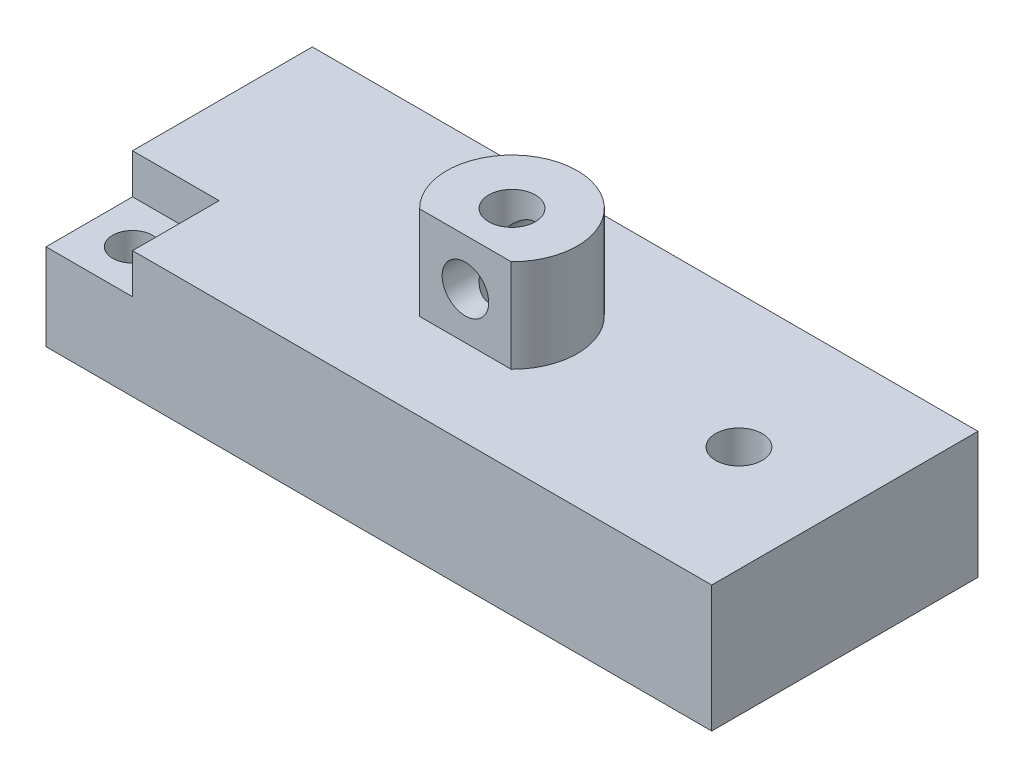
from build123d import *

# Parameters (mm, degrees)
SKETCH_1_W          = 100
SKETCH_1_H          = 40
EXTRUDE_1_DEPTH     = 19
SKETCH_2_R          = 9.811124868
EXTRUDE_2_DEPTH     = 14
SKETCH_3_W          = 13
SKETCH_3_H          = 13
CUT_EXTRUDE_1_DEPTH = 6
SKETCH_4_R          = 3
CUT_EXTRUDE_2_DEPTH = 110.544511501
SKETCH_5_R          = 3.5
CUT_EXTRUDE_3_DEPTH = 113.645461515
SKETCH_6_R          = 3.5
CUT_EXTRUDE_4_DEPTH = 110.366356801
SKETCH_7_W          = 87
SKETCH_7_H          = 13
CUT_EXTRUDE_6_DEPTH = 31
SKETCH_8_R          = 3.5
CUT_EXTRUDE_7_DEPTH = 109.710625056


with BuildPart() as part:
    # Эскиз1 → Бобышка-Вытянуть1 (new body)
    with BuildSketch(Plane(origin=(0, 0, 0), x_dir=(1, 0, 0), z_dir=(0, 1, 0))):
        with Locations((-50, 20)):
            Rectangle(SKETCH_1_W, SKETCH_1_H)
    extrude(amount=EXTRUDE_1_DEPTH)

    # Эскиз2 → Бобышка-Вытянуть2 (add)
    with BuildSketch(Plane(origin=(0, 19, 0), x_dir=(1, 0, 0), z_dir=(0, 1, 0))):
        with Locations(Location((-50, 20, 0), (0, 0, 270))):
            Circle(SKETCH_2_R)
    extrude(amount=EXTRUDE_2_DEPTH)

    # Эскиз3 → Вырез-Вытянуть1 (cut)
    with BuildSketch(Plane(origin=(0, 19, 0), x_dir=(1, 0, 0), z_dir=(0, 1, 0))):
        with Locations((-93.5, 6.5)):
            Rectangle(SKETCH_3_W, SKETCH_3_H)
    extrude(amount=-CUT_EXTRUDE_1_DEPTH, mode=Mode.SUBTRACT)

    # Эскиз4 → Вырез-Вытянуть2 (cut, through all)
    with BuildSketch(Plane(origin=(0, 13, 0), x_dir=(1, 0, 0), z_dir=(0, 1, 0))):
        with Locations(Location((-93.5, 6.5, 0), (0, 0, 270))):
            Circle(SKETCH_4_R)
    extrude(amount=-CUT_EXTRUDE_2_DEPTH, mode=Mode.SUBTRACT)

    # Эскиз5 → Вырез-Вытянуть3 (cut, through all)
    with BuildSketch(Plane(origin=(0, 33, 0), x_dir=(1, 0, 0), z_dir=(0, 1, 0))):
        with Locations(Location((-50, 20, 0), (0, 0, 270))):
            Circle(SKETCH_5_R)
    extrude(amount=-CUT_EXTRUDE_3_DEPTH, mode=Mode.SUBTRACT)

    # Эскиз6 → Вырез-Вытянуть4 (cut, through all)
    with BuildSketch(Plane(origin=(0, 19, 0), x_dir=(1, 0, 0), z_dir=(0, 1, 0))):
        with Locations(Location((-15.91089824, 20, 0), (0, 0, 270))):
            Circle(SKETCH_6_R)
    extrude(amount=-CUT_EXTRUDE_4_DEPTH, mode=Mode.SUBTRACT)

    # Эскиз7 → Вырез-Вытянуть6 (cut)
    with BuildSketch(Plane(origin=(0, 19, 0), x_dir=(1, 0, 0), z_dir=(0, 1, 0))):
        with Locations((-43.5, 6.5)):
            Rectangle(SKETCH_7_W, SKETCH_7_H)
    extrude(amount=CUT_EXTRUDE_6_DEPTH, mode=Mode.SUBTRACT)

    # Эскиз8 → Вырез-Вытянуть7 (cut, through all)
    with BuildSketch(Plane.XY.offset(-13)):
        with Locations((-50, 26)):
            Circle(SKETCH_8_R)
    extrude(amount=-CUT_EXTRUDE_7_DEPTH, mode=Mode.SUBTRACT)


solid = part.part
